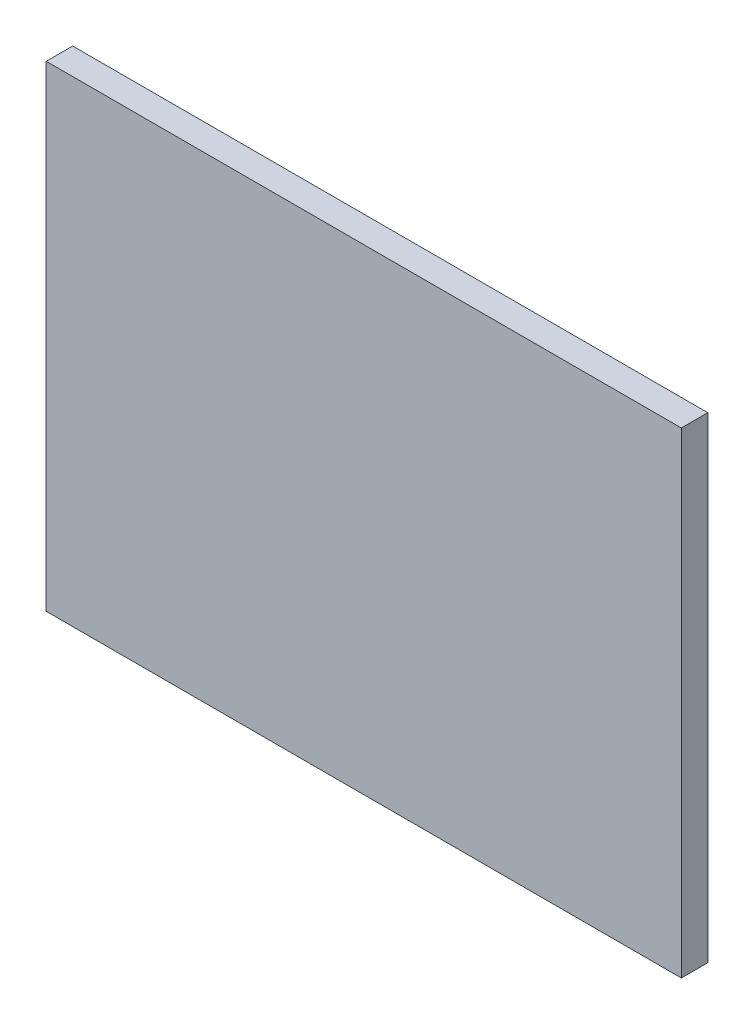
from build123d import *

# Parameters (mm, degrees)
SKETCH1_W           = 609.6
SKETCH1_H           = 457.2
BOSS_EXTRUDE1_DEPTH = 25.4


with BuildPart() as part:
    # Sketch1 → Boss-Extrude1 (new body)
    with BuildSketch(Plane.XY):
        with Locations((152.4, 228.6)):
            Rectangle(SKETCH1_W, SKETCH1_H)
    extrude(amount=BOSS_EXTRUDE1_DEPTH)


solid = part.part
